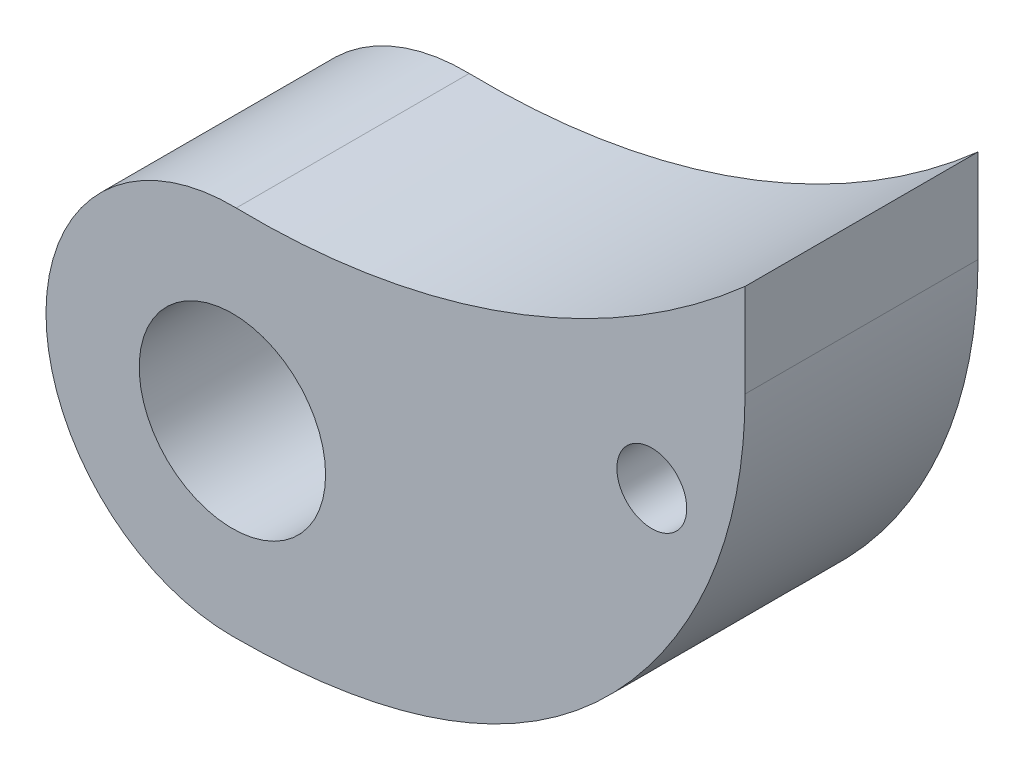
from build123d import *

# Parameters (mm, degrees)
SKETCH1_R           = 2
SKETCH1_R_2         = 0.75
BOSS_EXTRUDE1_DEPTH = 5


with BuildPart() as part:
    # Sketch1 → Boss-Extrude1 (new body)
    with BuildSketch(Plane.XY):
        with BuildLine():
            Line((11, 8), (11, 6))
            add(Edge.make_bspline(
                [(0, -4), (4.202034989, -4), (8.983292572, -1.556557567), (11, 3.648606594), (11, 6)],
                knots=[0, 0, 0, 0, 0.608953579, 1, 1, 1, 1], degree=3))
            ThreePointArc((0, -4), (-3.999787606, 0.041220208), (0.082436038, 3.999150447))
            ThreePointArc((0.082436038, 3.999150447), (5.917516541, 4.972727518), (11, 8))
        make_face()
        Circle(SKETCH1_R, mode=Mode.SUBTRACT)
        with Locations((9, 3.247888138)):
            Circle(SKETCH1_R_2, mode=Mode.SUBTRACT)
    extrude(amount=BOSS_EXTRUDE1_DEPTH)


solid = part.part
